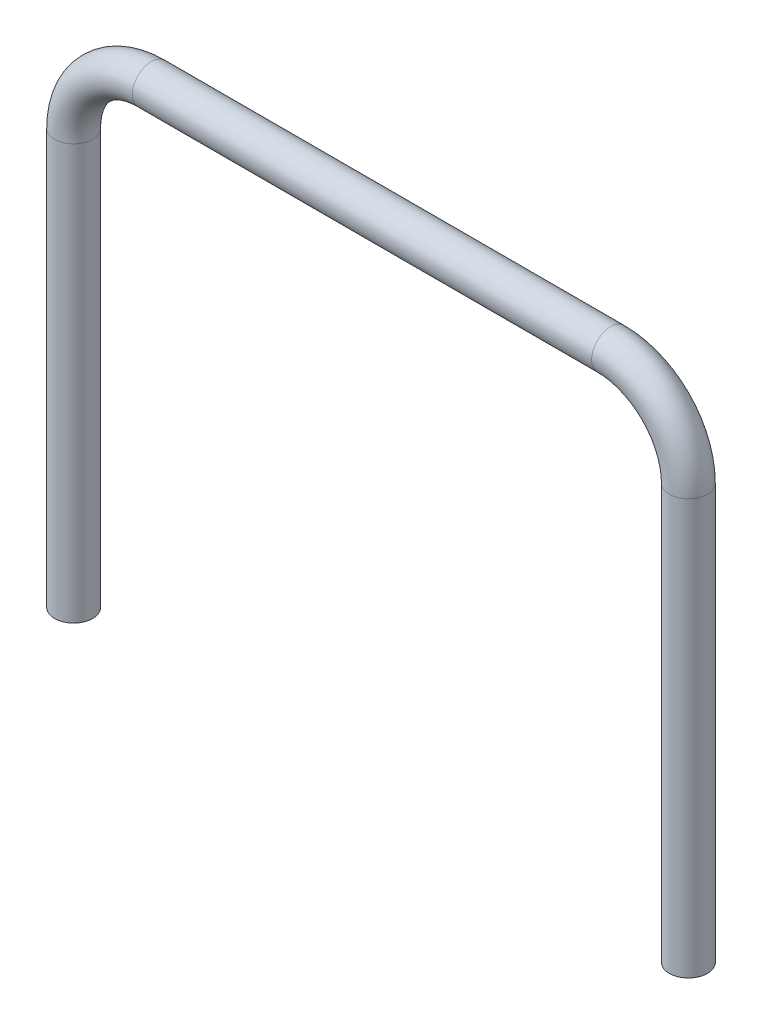
from build123d import *

# Parameters (mm, degrees)
SKETCH2_R = 0.6223


with BuildPart() as part:
    # Sweep1: sweep along a path in Sketch1
    with BuildLine(Plane.XY) as sweep1_path:
        Line((-10.0457, -16.1036), (-10.0457, -2.54))
        ThreePointArc((-10.0457, -2.54), (-9.301751224, -0.743948776), (-7.5057, 0))
        Line((-7.5057, 0), (7.5057, 0))
        ThreePointArc((7.5057, 0), (9.301751224, -0.743948776), (10.0457, -2.54))
        Line((10.0457, -2.54), (10.0457, -16.1036))
    # Sketch2 → Sweep1 (sweep)
    with BuildSketch(Plane(origin=(0, -16.1036, 0), x_dir=(1, 0, 0), z_dir=(0, 1, 0))):
        with Locations((-10.0457, 0)):
            Circle(SKETCH2_R)
    sweep(path=sweep1_path.line)


solid = part.part
